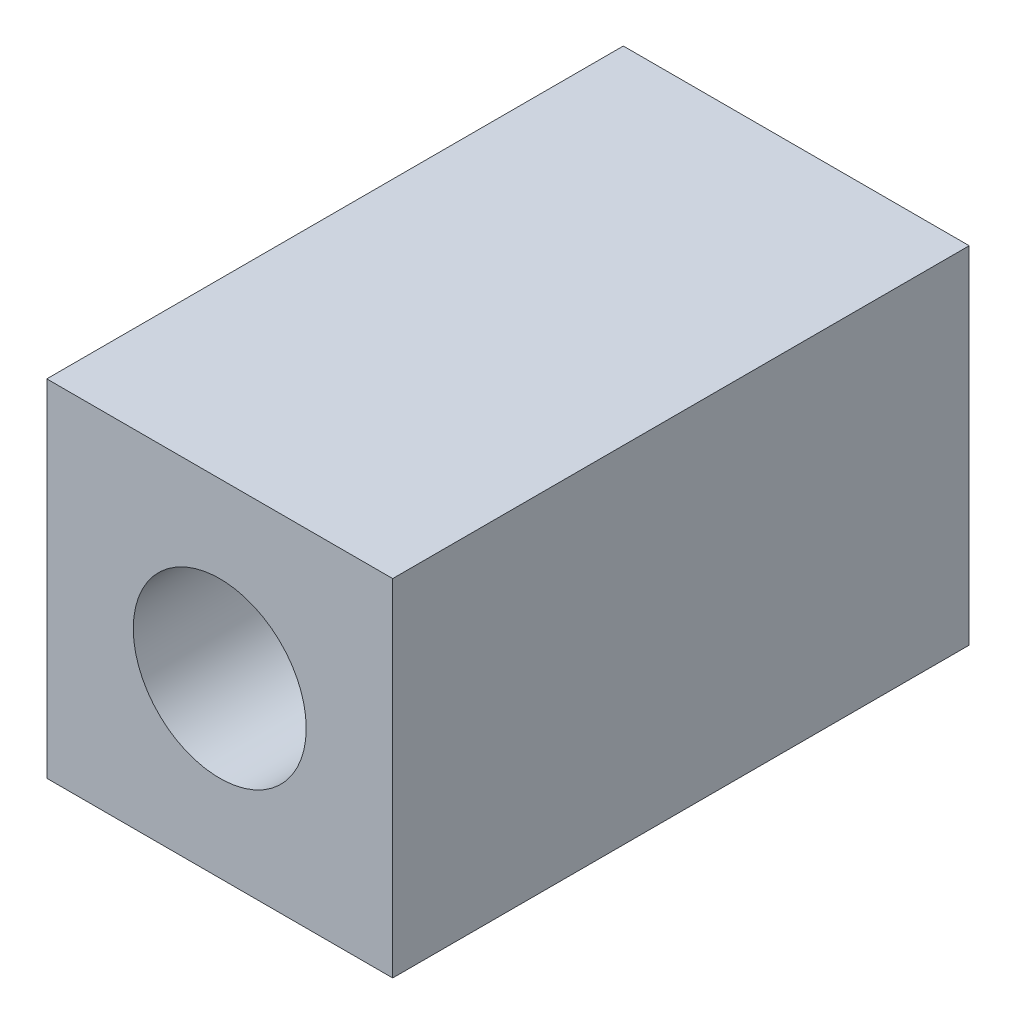
from build123d import *

# Parameters (mm, degrees)
SKETCH1_W           = 6
SKETCH1_H           = 6
SKETCH1_R           = 1.5
BOSS_EXTRUDE1_DEPTH = 10


with BuildPart() as part:
    # Sketch1 → Boss-Extrude1 (new body)
    with BuildSketch(Plane.XY):
        with Locations((-4.619047619, 1.888888889)):
            Rectangle(SKETCH1_W, SKETCH1_H)
        with Locations((-4.619047619, 1.888888889)):
            Circle(SKETCH1_R, mode=Mode.SUBTRACT)
    extrude(amount=BOSS_EXTRUDE1_DEPTH)


solid = part.part
